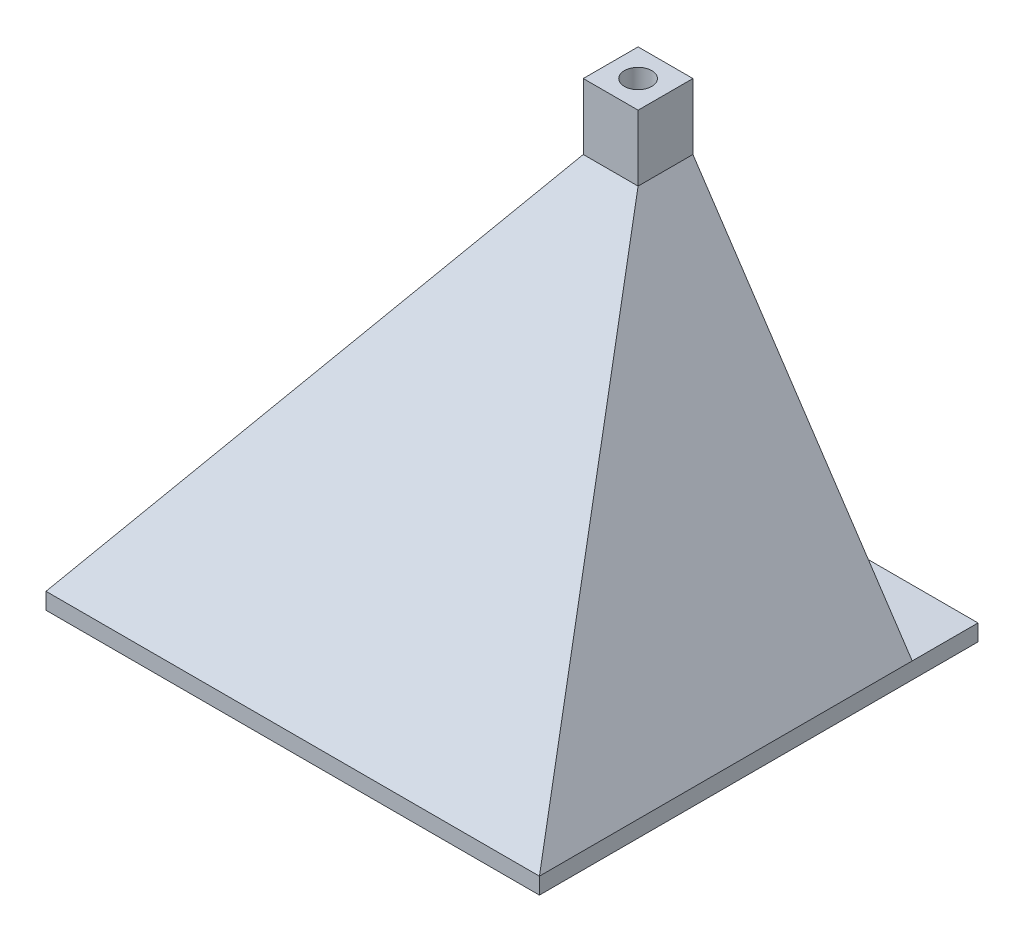
from build123d import *

# Parameters (mm, degrees)
SKETCH1_W           = 45
SKETCH1_H           = 40
SKETCH1_W_2         = 43
SKETCH1_H_2         = 32
BOSS_EXTRUDE1_DEPTH = 1.5
SHELL3_T            = -0.75
SKETCH7_W           = 5
SKETCH7_H           = 5
SKETCH7_R           = 1.25
BOSS_EXTRUDE2_DEPTH = 6
SKETCH8_R           = 1.7
CUT_EXTRUDE1_DEPTH  = 0.75


with BuildPart() as part:
    # Sketch1 → Boss-Extrude1 (new body)
    with BuildSketch(Plane(origin=(0, 0, 0), x_dir=(1, 0, 0), z_dir=(0, 1, 0))):
        Rectangle(SKETCH1_W, SKETCH1_H)
        with Locations((0, -3)):
            Rectangle(SKETCH1_W_2, SKETCH1_H_2, mode=Mode.SUBTRACT)
        with BuildLine():
            Line((-12.5, 18.7), (12.5, 18.7))
            ThreePointArc((12.5, 18.7), (14.2, 17), (12.5, 15.3))
            Line((12.5, 15.3), (-12.5, 15.3))
            ThreePointArc((-12.5, 15.3), (-14.2, 17), (-12.5, 18.7))
        make_face(mode=Mode.SUBTRACT)
    extrude(amount=BOSS_EXTRUDE1_DEPTH)


with BuildPart() as body_2:
    # Sketch5 → Loft3 section 0
    with BuildSketch(Plane(origin=(0, 1.5, 0), x_dir=(1, 0, 0), z_dir=(0, 1, 0))):
        with BuildLine():
            Line((-22.5, -20), (22.5, -20))
            Line((22.5, -20), (22.5, 14))
            Line((22.5, 14), (-22.5, 14))
            Line((-22.5, 14), (-22.5, -20))
        make_face()
    # Sketch6 → Loft3 section 1
    with BuildSketch(Plane(origin=(0, 31.5, 0), x_dir=(1, 0, 0), z_dir=(0, 1, 0))):
        with BuildLine():
            Line((-2.5, 9), (2.5, 9))
            Line((2.5, 9), (2.5, 14))
            Line((2.5, 14), (-2.5, 14))
            Line((-2.5, 14), (-2.5, 9))
        make_face()
    loft()

    # Shell3
    shell3_openings = [body_2.faces().sort_by_distance(p)[0] for p in [
        (0, 31.5, -11.5),
        (0, 1.5, 3),
    ]]
    offset(amount=SHELL3_T, openings=shell3_openings, kind=Kind.INTERSECTION)

    # Sketch7 → Boss-Extrude2 (add)
    with BuildSketch(Plane(origin=(0, 31.5, 0), x_dir=(1, 0, 0), z_dir=(0, 1, 0))):
        with Locations((0, 11.5)):
            Rectangle(SKETCH7_W, SKETCH7_H)
        with Locations(Location((0, 11.5, 0), (0, 0, 270))):
            Circle(SKETCH7_R, mode=Mode.SUBTRACT)
    extrude(amount=BOSS_EXTRUDE2_DEPTH)

    # Sketch8 → Cut-Extrude1 (cut)
    with BuildSketch(Plane(origin=(0, 0, -14), x_dir=(-1, 0, 0), z_dir=(0, 0, -1))):
        with Locations((0, 14.5)):
            Circle(SKETCH8_R)
    extrude(amount=-CUT_EXTRUDE1_DEPTH, mode=Mode.SUBTRACT)


solid = Compound([part.part, body_2.part])
